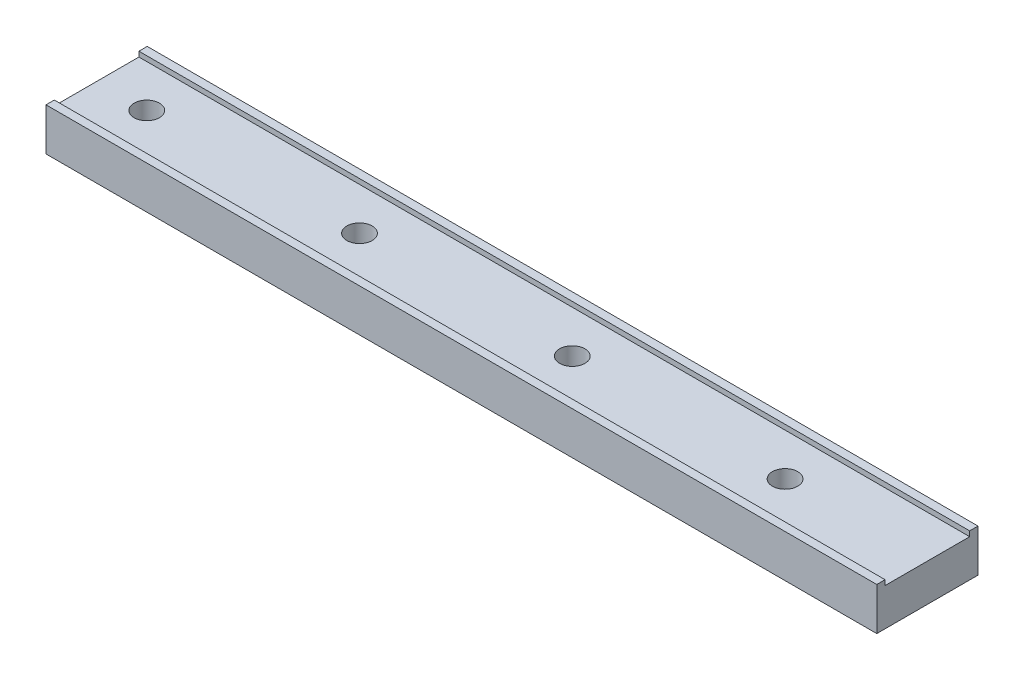
from build123d import *

# Parameters (mm, degrees)
SKETCH1_W           = 208.28
SKETCH1_H           = 25.3746
SKETCH1_R           = 3.175
BOSS_EXTRUDE1_DEPTH = 9.398
SKETCH2_W           = 208.28
SKETCH2_H           = 2.0828
BOSS_EXTRUDE2_DEPTH = 1.27


with BuildPart() as part:
    # Sketch1 → Boss-Extrude1 (new body)
    with BuildSketch(Plane(origin=(0, 0, 0), x_dir=(1, 0, 0), z_dir=(0, 1, 0))):
        Rectangle(SKETCH1_W, SKETCH1_H)
        with Locations(Location((-91.567, 0, 0), (0, 0, 270))):
            Circle(SKETCH1_R, mode=Mode.SUBTRACT)
        with Locations(Location((-38.227, 0, 0), (0, 0, 270))):
            Circle(SKETCH1_R, mode=Mode.SUBTRACT)
        with Locations(Location((15.113, 0, 0), (0, 0, 270))):
            Circle(SKETCH1_R, mode=Mode.SUBTRACT)
        with Locations(Location((68.453, 0, 0), (0, 0, 270))):
            Circle(SKETCH1_R, mode=Mode.SUBTRACT)
    extrude(amount=BOSS_EXTRUDE1_DEPTH)

    # Sketch2 → Boss-Extrude2 (add)
    with BuildSketch(Plane(origin=(0, 9.398, 0), x_dir=(1, 0, 0), z_dir=(0, 1, 0))):
        with Locations((0, 11.6459)):
            Rectangle(SKETCH2_W, SKETCH2_H)
        with Locations((0, -11.6459)):
            Rectangle(SKETCH2_W, SKETCH2_H)
    extrude(amount=BOSS_EXTRUDE2_DEPTH)


solid = part.part
